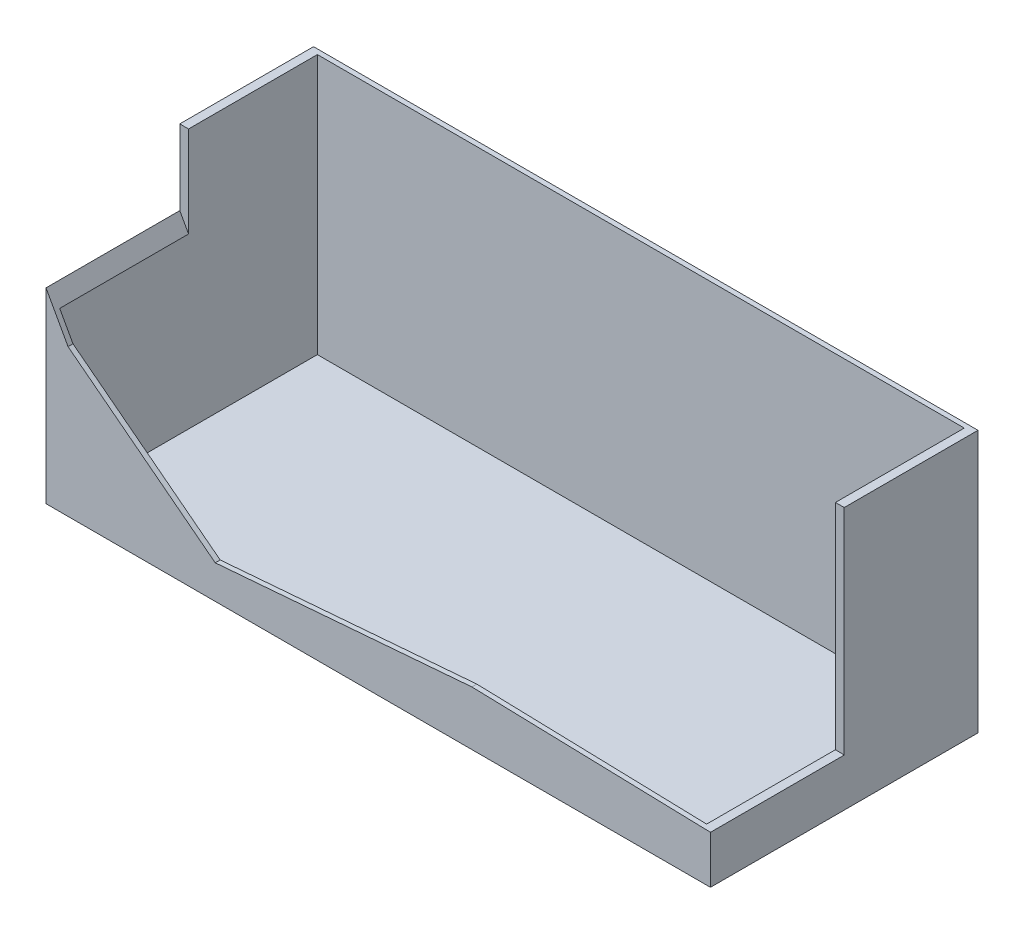
from build123d import *

# Parameters (mm, degrees)
SKETCH1_W           = 6060
SKETCH1_H           = 2440
SKETCH1_W_2         = 5900
SKETCH1_H_2         = 2350
BOSS_EXTRUDE1_DEPTH = 2390
CUT_EXTRUDE1_DEPTH  = 4048.394223448
SKETCH3_W           = 6060
SKETCH3_H           = 2440
BOSS_EXTRUDE2_DEPTH = 20


with BuildPart() as part:
    # Sketch1 → Boss-Extrude1 (new body)
    with BuildSketch(Plane(origin=(0, 0, 0), x_dir=(1, 0, 0), z_dir=(0, 1, 0))):
        Rectangle(SKETCH1_W, SKETCH1_H)
        Rectangle(SKETCH1_W_2, SKETCH1_H_2, mode=Mode.SUBTRACT)
    extrude(amount=BOSS_EXTRUDE1_DEPTH)

    # Sketch2 → Cut-Extrude1 (cut, through all)
    with BuildSketch(Plane.XY):
        Polygon((-2829.06610651, 1341.250261684), (-1486.384719245, 305.017377158), (854.001038063, 495.020178739), (4288.412334885, 400.018777949), (4288.412334885, 2458.605327612), (-3446.157527287, 2458.605327612), align=None)
    extrude(amount=CUT_EXTRUDE1_DEPTH, mode=Mode.SUBTRACT)

    # Sketch3 → Boss-Extrude2 (add)
    with BuildSketch(Plane.XZ):
        Rectangle(SKETCH3_W, SKETCH3_H)
    extrude(amount=-BOSS_EXTRUDE2_DEPTH)


solid = part.part
